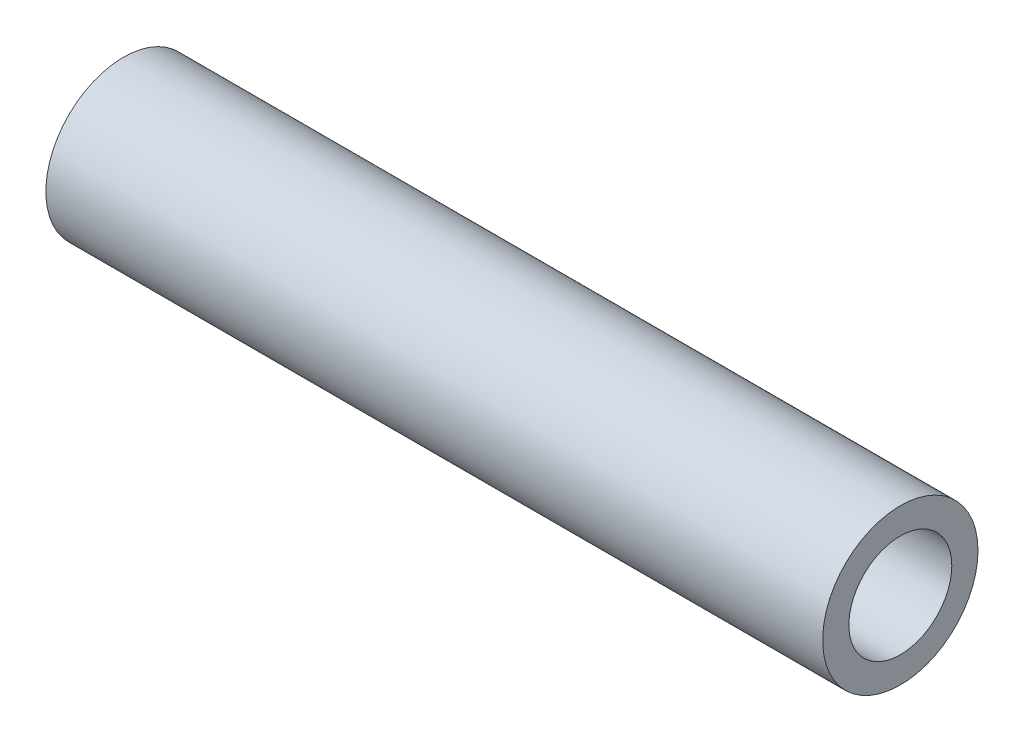
from build123d import *

# Parameters (mm, degrees)
SKETCH1_R           = 4
SKETCH1_R_2         = 2.65
BOSS_EXTRUDE1_DEPTH = 40


with BuildPart() as part:
    # Sketch1 → Boss-Extrude1 (new body)
    with BuildSketch(Plane(origin=(0, 0, 0), x_dir=(0, 0, -1), z_dir=(1, 0, 0))):
        Circle(SKETCH1_R)
        Circle(SKETCH1_R_2, mode=Mode.SUBTRACT)
    extrude(amount=BOSS_EXTRUDE1_DEPTH)


solid = part.part
